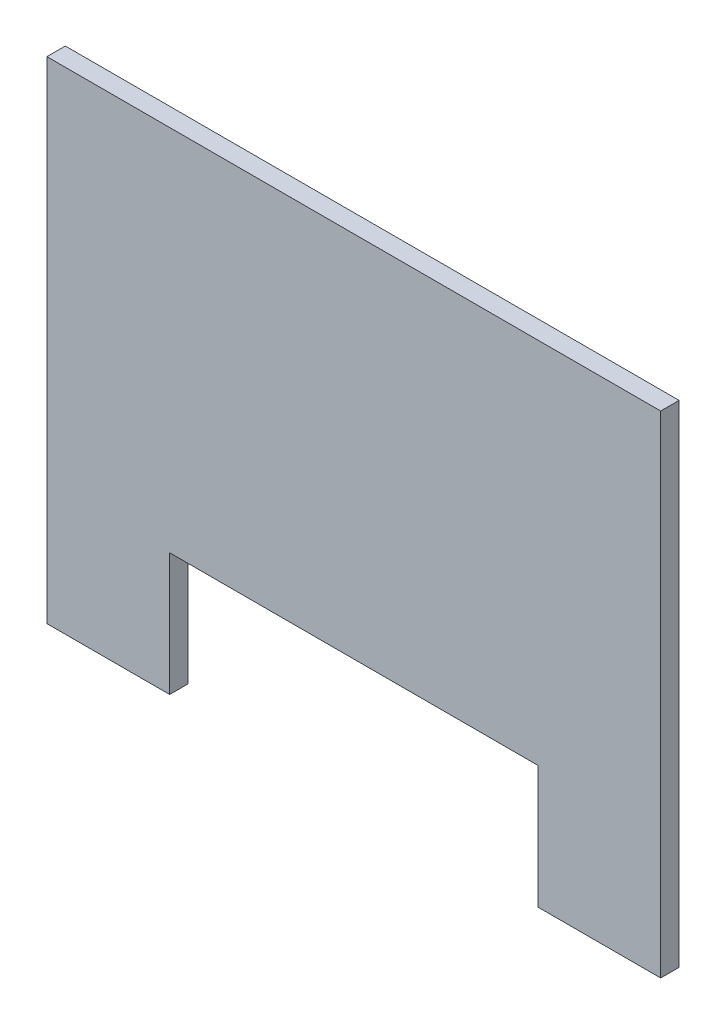
from build123d import *

# Parameters (mm, degrees)
BOSS_EXTRU_1_DEPTH = 3


with BuildPart() as part:
    # Esquisse1 → Boss.-Extru.1 (new body)
    with BuildSketch(Plane.XY):
        Polygon((-16.601489083, -41.072056239), (43.398510917, -41.072056239), (43.398510917, -61.072056239), (63.398510917, -61.072056239), (63.398510917, -26.414762742), (63.398510917, 18.927943761), (-36.601489083, 18.927943761), (-36.601489083, -21.001757469), (-36.601489083, -61.072056239), (-16.601489083, -61.072056239), align=None)
    extrude(amount=BOSS_EXTRU_1_DEPTH)


solid = part.part
